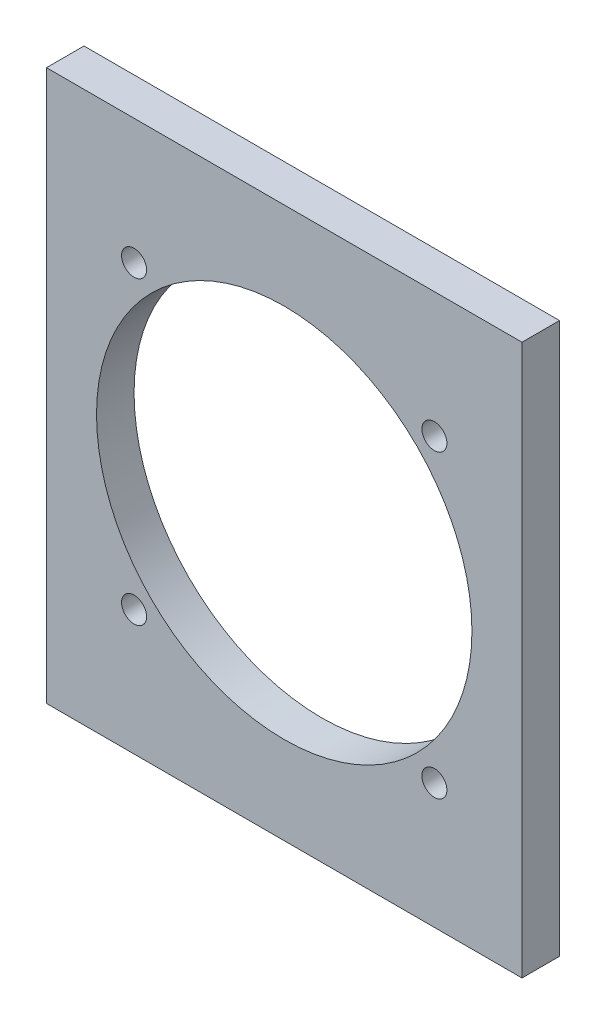
from build123d import *

# Parameters (mm, degrees)
SKETCH1_W           = 190
SKETCH1_H           = 220
BOSS_EXTRUDE1_DEPTH = 15
SKETCH2_R           = 75
SKETCH2_R_2         = 5
CUT_EXTRUDE1_DEPTH  = 15


with BuildPart() as part:
    # Sketch1 → Boss-Extrude1 (new body)
    with BuildSketch(Plane.XY):
        Rectangle(SKETCH1_W, SKETCH1_H)
    extrude(amount=BOSS_EXTRUDE1_DEPTH)

    # Sketch2 → Cut-Extrude1 (cut)
    with BuildSketch(Plane.XY.offset(15)):
        Circle(SKETCH2_R)
        with Locations((-60, 60)):
            Circle(SKETCH2_R_2)
        with Locations((60, 60)):
            Circle(SKETCH2_R_2)
        with Locations((60, -60)):
            Circle(SKETCH2_R_2)
        with Locations((-60, -60)):
            Circle(SKETCH2_R_2)
    extrude(amount=-CUT_EXTRUDE1_DEPTH, mode=Mode.SUBTRACT)


solid = part.part
